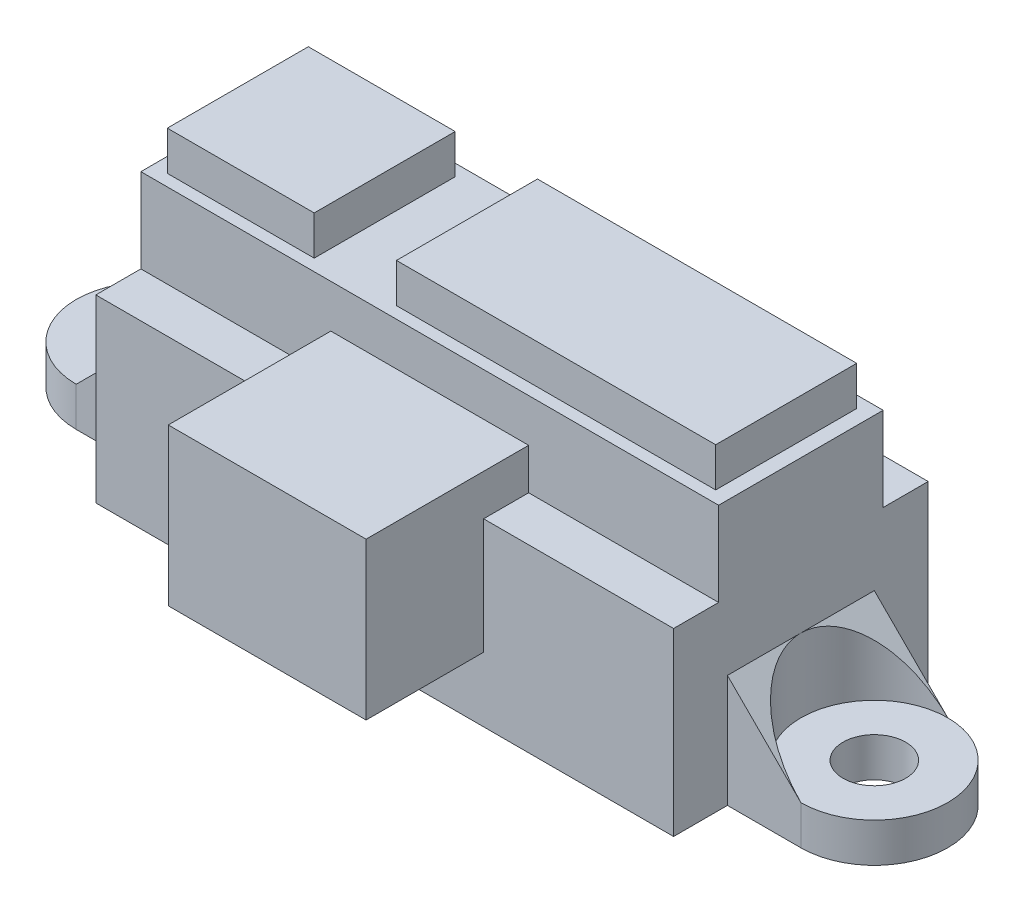
from build123d import *

# Parameters (mm, degrees)
SKETCH1_R      = 1.6
EXTRUDE1_DEPTH = 10
EXTRUDE2_DEPTH = 10
SKETCH3_R      = 3.75
EXTRUDE3_DEPTH = 10
SKETCH4_W      = 29.5
SKETCH4_H      = 13
EXTRUDE4_DEPTH = 9.2
SKETCH5_W      = 29.5
SKETCH5_H      = 8.4
EXTRUDE5_DEPTH = 4.3
SKETCH6_W      = 7.5
SKETCH6_H      = 7.2
SKETCH6_W_2    = 16.3
EXTRUDE6_DEPTH = 2
SKETCH7_W      = 10.1
SKETCH7_H      = 8
EXTRUDE7_DEPTH = 12.5


with BuildPart() as part:
    # Sketch1 → Extrude1 (new body)
    with BuildSketch(Plane(origin=(0, 0, 0), x_dir=(1, 0, 0), z_dir=(0, 1, 0))):
        with BuildLine():
            Line((-18.5, -3.75), (18.5, -3.75))
            ThreePointArc((18.5, -3.75), (22.25, 0), (18.5, 3.75))
            Line((18.5, 3.75), (-18.5, 3.75))
            ThreePointArc((-18.5, 3.75), (-22.25, 0), (-18.5, -3.75))
        make_face()
        with Locations(Location((18.5, 0, 0), (0, 0, 270))):
            Circle(SKETCH1_R, mode=Mode.SUBTRACT)
        with Locations(Location((-18.5, 0, 0), (0, 0, 270))):
            Circle(SKETCH1_R, mode=Mode.SUBTRACT)
    extrude(amount=EXTRUDE1_DEPTH)

    # Sketch2 → Extrude2 (cut)
    with BuildSketch(Plane.XY.offset(3.75)):
        Polygon((-22.25, 2), (-18.5, 2), (-10.5, 10), (10.5, 10), (18.5, 2), (22.25, 2), (22.25, 12), (-22.25, 12), align=None)
    extrude(amount=-EXTRUDE2_DEPTH, mode=Mode.SUBTRACT)

    # Sketch3 → Extrude3 (cut)
    with BuildSketch(Plane(origin=(0, 2, 0), x_dir=(1, 0, 0), z_dir=(0, 1, 0))):
        with Locations((-18.5, 0)):
            Circle(SKETCH3_R)
        with Locations((18.5, 0)):
            Circle(SKETCH3_R)
    extrude(amount=EXTRUDE3_DEPTH, mode=Mode.SUBTRACT)

    # Sketch4 → Extrude4 (add)
    with BuildSketch(Plane.XZ):
        Rectangle(SKETCH4_W, SKETCH4_H)
    extrude(amount=-EXTRUDE4_DEPTH)

    # Sketch5 → Extrude5 (add)
    with BuildSketch(Plane(origin=(0, 9.2, 0), x_dir=(1, 0, 0), z_dir=(0, 1, 0))):
        Rectangle(SKETCH5_W, SKETCH5_H)
    extrude(amount=EXTRUDE5_DEPTH)

    # Sketch6 → Extrude6 (add)
    with BuildSketch(Plane(origin=(0, 13.5, 0), x_dir=(1, 0, 0), z_dir=(0, 1, 0))):
        with Locations((-10.25, 0)):
            Rectangle(SKETCH6_W, SKETCH6_H)
        with Locations((5.85, 0)):
            Rectangle(SKETCH6_W_2, SKETCH6_H)
    extrude(amount=EXTRUDE6_DEPTH)

    # Sketch7 → Extrude7 (add)
    with BuildSketch(Plane.XY):
        with Locations((0, 7.3)):
            Rectangle(SKETCH7_W, SKETCH7_H)
    extrude(amount=EXTRUDE7_DEPTH)


solid = part.part
